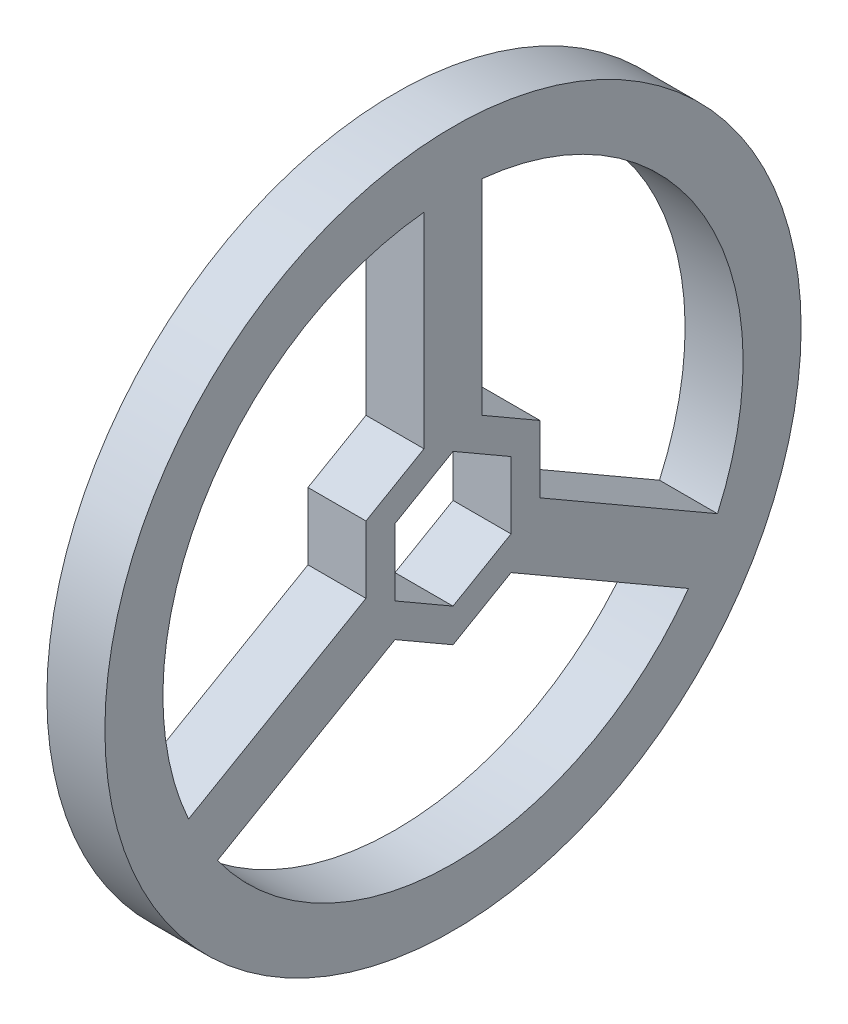
from build123d import *

# Parameters (mm, degrees)
BOSS_EXTRUDE1_DEPTH = 5


with BuildPart() as part:
    # Sketch1 → Boss-Extrude1 (new body)
    with BuildSketch(Plane(origin=(0, 0, 0), x_dir=(0, 0, -1), z_dir=(1, 0, 0))):
        with BuildLine():
            Line((2.5, 29.895651858), (2.5, 24.874685928))
            ThreePointArc((2.5, 24.874685928), (18.540496218, 16.770509831), (25, 0))
            ThreePointArc((25, 0), (24.441795639, -5.253439439), (22.792109925, -10.272279454))
            Line((22.792109925, -10.272279454), (27.140393972, -12.782762419))
            ThreePointArc((27.140393972, -12.782762419), (29.276371182, -6.549358016), (30, 0))
            ThreePointArc((30, 0), (22.079402166, 20.310096012), (2.5, 29.895651858))
        make_face()
        with BuildLine():
            ThreePointArc((-22.792109925, -10.272279454), (-21.650635095, 12.5), (-2.5, 24.874685928))
            Line((-2.5, 24.874685928), (-2.5, 29.895651858))
            ThreePointArc((-2.5, 29.895651858), (-25.980762114, 15), (-27.140393972, -12.782762419))
            Line((-27.140393972, -12.782762419), (-22.792109925, -10.272279454))
        make_face()
        with BuildLine():
            Line((-2.5, 29.895651858), (-2.5, 24.874685928))
            ThreePointArc((-2.5, 24.874685928), (0, 25), (2.5, 24.874685928))
            Line((2.5, 24.874685928), (2.5, 29.895651858))
            ThreePointArc((2.5, 29.895651858), (0, 30), (-2.5, 29.895651858))
        make_face()
        with BuildLine():
            ThreePointArc((22.792109925, -10.272279454), (21.650635095, -12.5), (20.292109925, -14.602406473))
            Line((20.292109925, -14.602406473), (24.640393972, -17.112889438))
            ThreePointArc((24.640393972, -17.112889438), (25.980762114, -15), (27.140393972, -12.782762419))
            Line((27.140393972, -12.782762419), (22.792109925, -10.272279454))
        make_face()
        with BuildLine():
            ThreePointArc((20.292109925, -14.602406473), (0, -25), (-20.292109925, -14.602406473))
            Line((-20.292109925, -14.602406473), (-24.640393972, -17.112889438))
            ThreePointArc((-24.640393972, -17.112889438), (0, -30), (24.640393972, -17.112889438))
            Line((24.640393972, -17.112889438), (20.292109925, -14.602406473))
        make_face()
        with BuildLine():
            ThreePointArc((-20.292109925, -14.602406473), (-21.650635095, -12.5), (-22.792109925, -10.272279454))
            Line((-22.792109925, -10.272279454), (-27.140393972, -12.782762419))
            ThreePointArc((-27.140393972, -12.782762419), (-25.980762114, -15), (-24.640393972, -17.112889438))
            Line((-24.640393972, -17.112889438), (-20.292109925, -14.602406473))
        make_face()
        with BuildLine():
            Line((7.5, -4.330127019), (5, -5.773502692))
            Line((5, -5.773502692), (20.292109925, -14.602406473))
            ThreePointArc((20.292109925, -14.602406473), (21.650635095, -12.5), (22.792109925, -10.272279454))
            Line((22.792109925, -10.272279454), (7.5, -1.443375673))
            Line((7.5, -1.443375673), (7.5, -4.330127019))
        make_face()
        with BuildLine():
            Line((-7.5, -4.330127019), (-7.5, -1.443375673))
            Line((-7.5, -1.443375673), (-22.792109925, -10.272279454))
            ThreePointArc((-22.792109925, -10.272279454), (-21.650635095, -12.5), (-20.292109925, -14.602406473))
            Line((-20.292109925, -14.602406473), (-5, -5.773502692))
            Line((-5, -5.773502692), (-7.5, -4.330127019))
        make_face()
        with BuildLine():
            Line((-2.5, 24.874685928), (-2.5, 7.216878365))
            Line((-2.5, 7.216878365), (0, 8.660254038))
            Line((0, 8.660254038), (2.5, 7.216878365))
            Line((2.5, 7.216878365), (2.5, 24.874685928))
            ThreePointArc((2.5, 24.874685928), (0, 25), (-2.5, 24.874685928))
        make_face()
        Polygon((-5, 2.886751346), (-2.5, 4.330127019), (-2.5, 7.216878365), (-7.5, 4.330127019), (-7.5, -1.443375673), (-5, 0), align=None)
        Polygon((-2.5, 7.216878365), (-2.5, 4.330127019), (0, 5.773502692), (2.5, 4.330127019), (2.5, 7.216878365), (0, 8.660254038), align=None)
        Polygon((2.5, 7.216878365), (2.5, 4.330127019), (5, 2.886751346), (5, 0), (7.5, -1.443375673), (7.5, 4.330127019), align=None)
        Polygon((5, -2.886751346), (2.5, -4.330127019), (5, -5.773502692), (7.5, -4.330127019), (7.5, -1.443375673), (5, 0), align=None)
        Polygon((5, -5.773502692), (2.5, -4.330127019), (0, -5.773502692), (-2.5, -4.330127019), (-5, -5.773502692), (0, -8.660254038), align=None)
        Polygon((-5, -2.886751346), (-5, 0), (-7.5, -1.443375673), (-7.5, -4.330127019), (-5, -5.773502692), (-2.5, -4.330127019), align=None)
    extrude(amount=BOSS_EXTRUDE1_DEPTH)


solid = part.part
